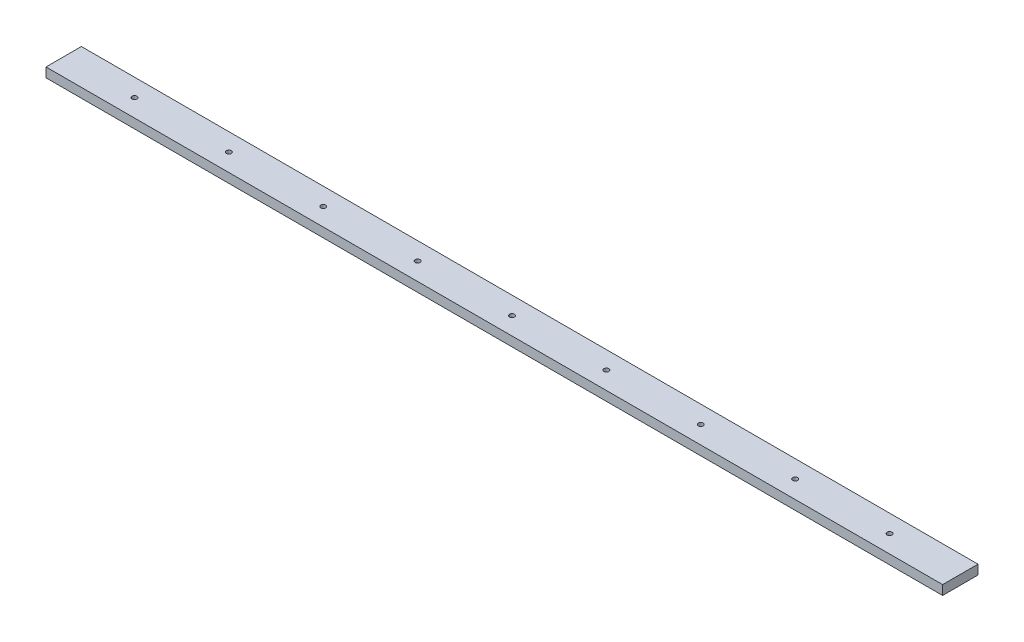
from build123d import *

# Parameters (mm, degrees)
SKETCH1_W           = 760
SKETCH1_H           = 30
BOSS_EXTRUDE1_DEPTH = 8
M5_TAPPED_HOLE1_D   = 4.2


with BuildPart() as part:
    # Sketch1 → Boss-Extrude1 (new body)
    with BuildSketch(Plane(origin=(0, 0, 0), x_dir=(1, 0, 0), z_dir=(0, 1, 0))):
        Rectangle(SKETCH1_W, SKETCH1_H)
    extrude(amount=BOSS_EXTRUDE1_DEPTH)

    # M5 Tapped Hole1 (through all)
    with Locations(Plane(origin=(0, 8, 0), x_dir=(1, 0, 0), z_dir=(0, 1, 0))):
        with Locations((0, 0), (80, 0), (160, 0), (240, 0), (320, 0), (-80, 0), (-160, 0), (-240, 0), (-320, 0)):
            Hole(M5_TAPPED_HOLE1_D / 2)


solid = part.part
